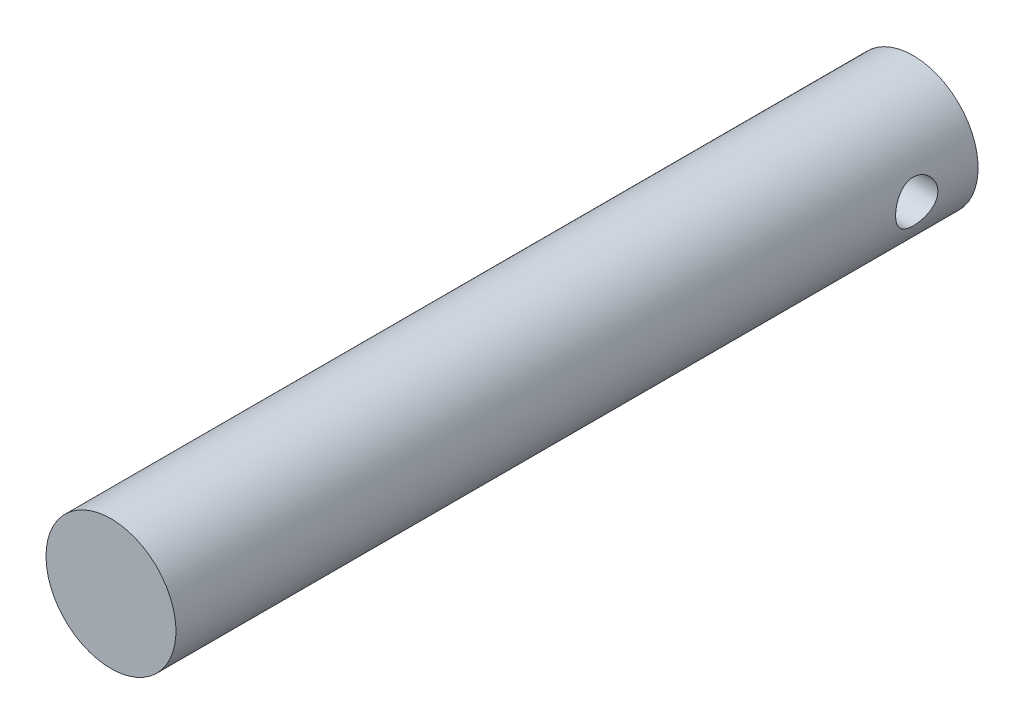
from build123d import *

# Parameters (mm, degrees)
SKETCH1_W           = 50
SKETCH1_H           = 50
BOSS_EXTRUDE1_DEPTH = 123.5
SKETCH2_R           = 3.25
CUT_EXTRUDE1_DEPTH  = 50
SKETCH3_OUTSIDE_W   = 80.462
SKETCH3_OUTSIDE_H   = 80.462
SKETCH3_OUTSIDE_R   = 10
CUT_EXTRUDE2_DEPTH  = 123.5


with BuildPart() as part:
    # Sketch1 → Boss-Extrude1 (new body)
    with BuildSketch(Plane.XY):
        with Locations((2.064220183, 0.458715596)):
            Rectangle(SKETCH1_W, SKETCH1_H)
    extrude(amount=BOSS_EXTRUDE1_DEPTH)

    # Sketch2 → Cut-Extrude1 (cut)
    with BuildSketch(Plane.ZY.offset(22.935779817)):
        with Locations((9.45, 0.458715596)):
            Circle(SKETCH2_R)
    extrude(amount=-CUT_EXTRUDE1_DEPTH, mode=Mode.SUBTRACT)

    # Sketch3 outside → Cut-Extrude2 (cut)
    with BuildSketch(Plane(origin=(0, 0, 0), x_dir=(-1, 0, 0), z_dir=(0, 0, -1))):
        with Locations((-2.064, 0.459)):
            Rectangle(SKETCH3_OUTSIDE_W, SKETCH3_OUTSIDE_H)
        with Locations((-2.064220183, 0.458715596)):
            Circle(SKETCH3_OUTSIDE_R, mode=Mode.SUBTRACT)
    extrude(amount=-CUT_EXTRUDE2_DEPTH, mode=Mode.SUBTRACT)


solid = part.part
